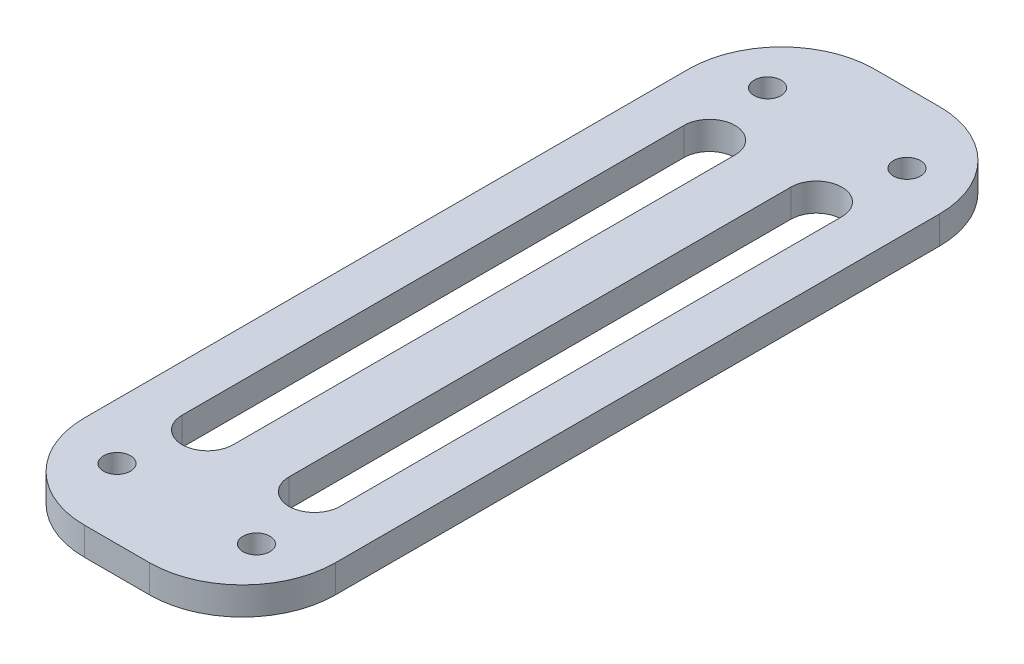
from build123d import *

# Parameters (mm, degrees)
SKETCH_1_W          = 27
SKETCH_1_H          = 85
EXTRUDE_1_DEPTH     = 3
SKETCH_2_R          = 1.45
CUT_EXTRUDE_1_DEPTH = 90.235643103
CUT_EXTRUDE_2_DEPTH = 90.235643103
FILLET_1_R          = 10


with BuildPart() as part:
    # 草图1 → 凸台-拉伸1 (new body)
    with BuildSketch(Plane(origin=(0, 0, 0), x_dir=(1, 0, 0), z_dir=(0, 1, 0))):
        with Locations((13.5, 42.5)):
            Rectangle(SKETCH_1_W, SKETCH_1_H)
    extrude(amount=EXTRUDE_1_DEPTH)

    # 草图2 → 切除-拉伸1 (cut, through all)
    with BuildSketch(Plane(origin=(0, 3, 0), x_dir=(1, 0, 0), z_dir=(0, 1, 0))):
        with Locations(Location((6, 7.5, 0), (0, 0, 270))):
            Circle(SKETCH_2_R)
        with Locations(Location((21, 7.5, 0), (0, 0, 90))):
            Circle(SKETCH_2_R)
        with Locations(Location((21, 77.5, 0), (0, 0, 270))):
            Circle(SKETCH_2_R)
        with Locations(Location((6, 77.5, 0), (0, 0, 90))):
            Circle(SKETCH_2_R)
    extrude(amount=-CUT_EXTRUDE_1_DEPTH, mode=Mode.SUBTRACT)

    # 草图3 → 切除-拉伸2 (cut, through all)
    with BuildSketch(Plane(origin=(0, 3, 0), x_dir=(1, 0, 0), z_dir=(0, 1, 0))):
        with BuildLine():
            Line((10.5, 69.5), (10.5, 15.5))
            ThreePointArc((10.5, 15.5), (7.75, 12.75), (5, 15.5))
            Line((5, 15.5), (5, 69.5))
            ThreePointArc((5, 69.5), (7.75, 72.25), (10.5, 69.5))
        make_face()
        with BuildLine():
            Line((16.5, 69.5), (16.5, 15.5))
            ThreePointArc((16.5, 15.5), (19.25, 12.75), (22, 15.5))
            Line((22, 15.5), (22, 69.5))
            ThreePointArc((22, 69.5), (19.25, 72.25), (16.5, 69.5))
        make_face()
    extrude(amount=-CUT_EXTRUDE_2_DEPTH, mode=Mode.SUBTRACT)

    # 圆角1
    fillet_1_edges = [part.edges().sort_by_distance(p)[0] for p in [
        (0, 1.5, -85),
        (27, 1.5, -85),
        (27, 1.5, 0),
        (0, 1.5, 0),
    ]]
    fillet(fillet_1_edges, radius=FILLET_1_R)


solid = part.part
